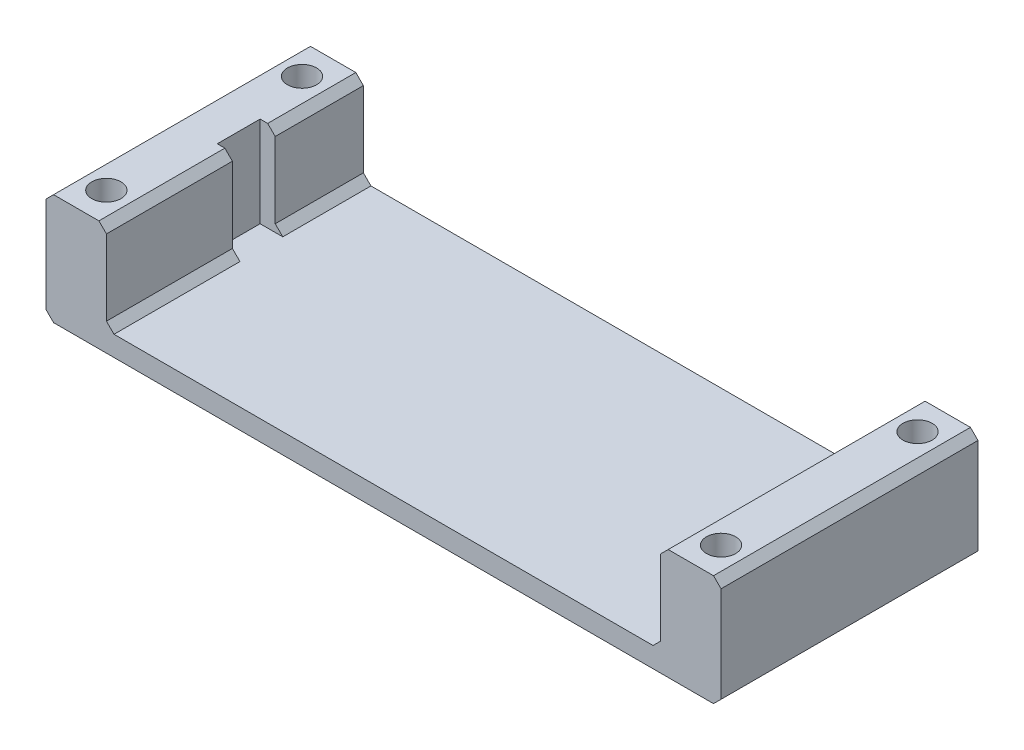
from build123d import *

# Parameters (mm, degrees)
SKETCH1_W           = 67
SKETCH1_H           = 25.5
BOSS_EXTRUDE1_DEPTH = 2
SKETCH3_W           = 6
SKETCH3_H           = 25.5
BOSS_EXTRUDE2_DEPTH = 9
BOSS_EXTRUDE3_DEPTH = 9
SKETCH6_R           = 1.45
CUT_EXTRUDE1_DEPTH  = 3
CHAMFER1_SIZE       = 0.75
SKETCH7_R           = 1.05
CUT_EXTRUDE2_DEPTH  = 3


with BuildPart() as part:
    # Sketch1 → Boss-Extrude1 (new body)
    with BuildSketch(Plane(origin=(0, 0, 0), x_dir=(1, 0, 0), z_dir=(0, 1, 0))):
        with Locations((33.5, 12.75)):
            Rectangle(SKETCH1_W, SKETCH1_H)
    extrude(amount=BOSS_EXTRUDE1_DEPTH)

    # Sketch3 → Boss-Extrude2 (add)
    with BuildSketch(Plane(origin=(0, 2, 0), x_dir=(1, 0, 0), z_dir=(0, 1, 0))):
        with Locations((64, 12.75)):
            Rectangle(SKETCH3_W, SKETCH3_H)
    extrude(amount=BOSS_EXTRUDE2_DEPTH)

    # Sketch4 → Boss-Extrude3 (add)
    with BuildSketch(Plane(origin=(0, 2, 0), x_dir=(1, 0, 0), z_dir=(0, 1, 0))):
        Polygon((0, 0), (6, 0), (6, 12.5), (4.5, 12.5), (4.5, 16.75), (6, 16.75), (6, 25.5), (0, 25.5), align=None)
    extrude(amount=BOSS_EXTRUDE3_DEPTH)

    # Sketch6 → Cut-Extrude1 (cut)
    with BuildSketch(Plane(origin=(0, 11, 0), x_dir=(1, 0, 0), z_dir=(0, 1, 0))):
        with Locations(Location((2.911463201, 22.5, 0), (0, 0, 270))):
            Circle(SKETCH6_R)
        with Locations(Location((2.988195093, 3, 0), (0, 0, 270))):
            Circle(SKETCH6_R)
        with Locations(Location((64, 22.5, 0), (0, 0, 270))):
            Circle(SKETCH6_R)
        with Locations(Location((64, 3, 0), (0, 0, 270))):
            Circle(SKETCH6_R)
    extrude(amount=-CUT_EXTRUDE1_DEPTH, mode=Mode.SUBTRACT)

    # Chamfer1
    chamfer1_edges = [part.edges().sort_by_distance(p)[0] for p in [
        (61, 2, -12.75),
        (67, 11, -12.75),
        (61, 11, -12.75),
        (6, 2, -6.25),
        (6, 2, -21.125),
        (0, 11, -12.75),
        (6, 11, -6.25),
        (6, 11, -21.125),
        (67, 0, -12.75),
        (0, 0, -12.75),
    ]]
    chamfer(chamfer1_edges, length=CHAMFER1_SIZE)

    # Sketch7 → Cut-Extrude2 (cut)
    with BuildSketch(Plane(origin=(0, 8, 0), x_dir=(1, 0, 0), z_dir=(0, 1, 0))):
        with Locations(Location((2.911463201, 22.5, 0), (0, 0, 270))):
            Circle(SKETCH7_R)
        with Locations(Location((2.988195093, 3, 0), (0, 0, 270))):
            Circle(SKETCH7_R)
        with Locations(Location((64, 3, 0), (0, 0, 270))):
            Circle(SKETCH7_R)
        with Locations(Location((64, 22.5, 0), (0, 0, 270))):
            Circle(SKETCH7_R)
    extrude(amount=-CUT_EXTRUDE2_DEPTH, mode=Mode.SUBTRACT)


solid = part.part
